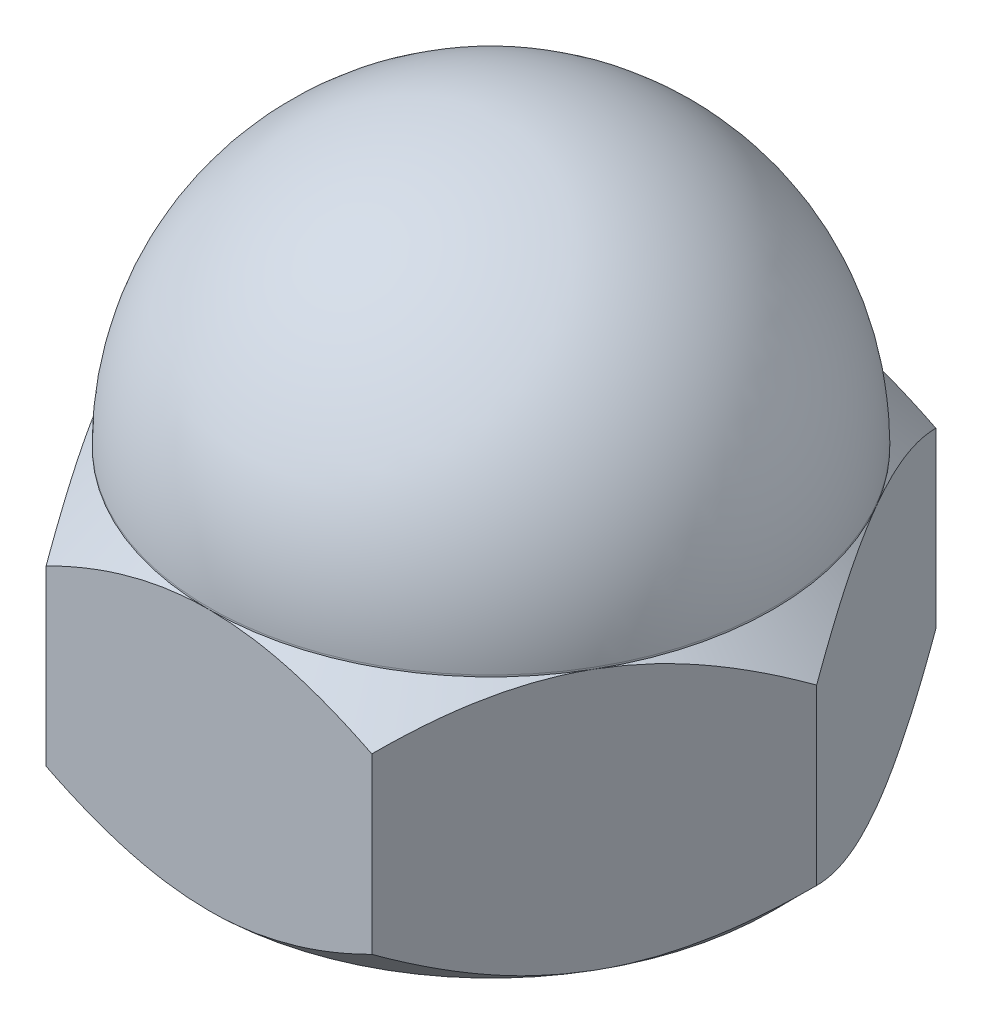
from build123d import *

# Parameters (mm, degrees)
BOSS_EXTRUDE1_DEPTH       = 16
F_1_0MM_DOWEL_HOLE1_D     = 20
F_1_0MM_DOWEL_HOLE1_DEPTH = 26.4
F_1_0MM_DOWEL_HOLE1_TIP   = 6.00860619


with BuildPart() as part:
    # Sketch1 → Boss-Extrude1 (new body)
    with BuildSketch(Plane(origin=(0, 0, 0), x_dir=(1, 0, 0), z_dir=(0, 1, 0))):
        Polygon((19.975, 0), (9.9875, 17.298857441), (-9.9875, 17.298857441), (-19.975, 0), (-9.9875, -17.298857441), (9.9875, -17.298857441), align=None)
    extrude(amount=BOSS_EXTRUDE1_DEPTH)

    # Sketch2 → Revolve1 (revolve)
    with BuildSketch(Plane.ZY):
        with BuildLine():
            Line((-17.298857441, 16), (-17.298857441, 16.101142559))
            ThreePointArc((-17.298857441, 16.101142559), (-12.232139403, 28.333281962), (0, 33.4))
            Line((0, 33.4), (0, 16))
            Line((0, 16), (-17.298857441, 16))
        make_face()
    revolve(axis=Axis((0, 16, 0), (0, 1, 0)))

    # Ø1.0mm Dowel Hole1
    with Locations(Plane(origin=(0, 0, 0), x_dir=(-1, 0, 0), z_dir=(0, -1, 0))):
        with Locations((0, 0)):
            Hole(F_1_0MM_DOWEL_HOLE1_D / 2, depth=F_1_0MM_DOWEL_HOLE1_DEPTH)
            with Locations((0, 0, -(F_1_0MM_DOWEL_HOLE1_DEPTH + F_1_0MM_DOWEL_HOLE1_TIP / 2))):  # 118° drill point
                Cone(0, F_1_0MM_DOWEL_HOLE1_D / 2, F_1_0MM_DOWEL_HOLE1_TIP, mode=Mode.SUBTRACT)

    # Sketch6 → Cut-Revolve1 (revolve, cut)
    with BuildSketch(Plane.XY, mode=Mode.PRIVATE) as cut_revolve1_sk:
        Polygon((17.298857441, 16), (19.975, 13.323857441), (19.975, 16), align=None)
        Polygon((19.975, 2.676142559), (19.975, 0), (17.298857441, 0), align=None)
    revolve(cut_revolve1_sk.sketch.rotate(Axis((0, 16, 0), (0, 1, 0)), 90), axis=Axis((0, 16, 0), (0, 1, 0)), mode=Mode.SUBTRACT)


solid = part.part
